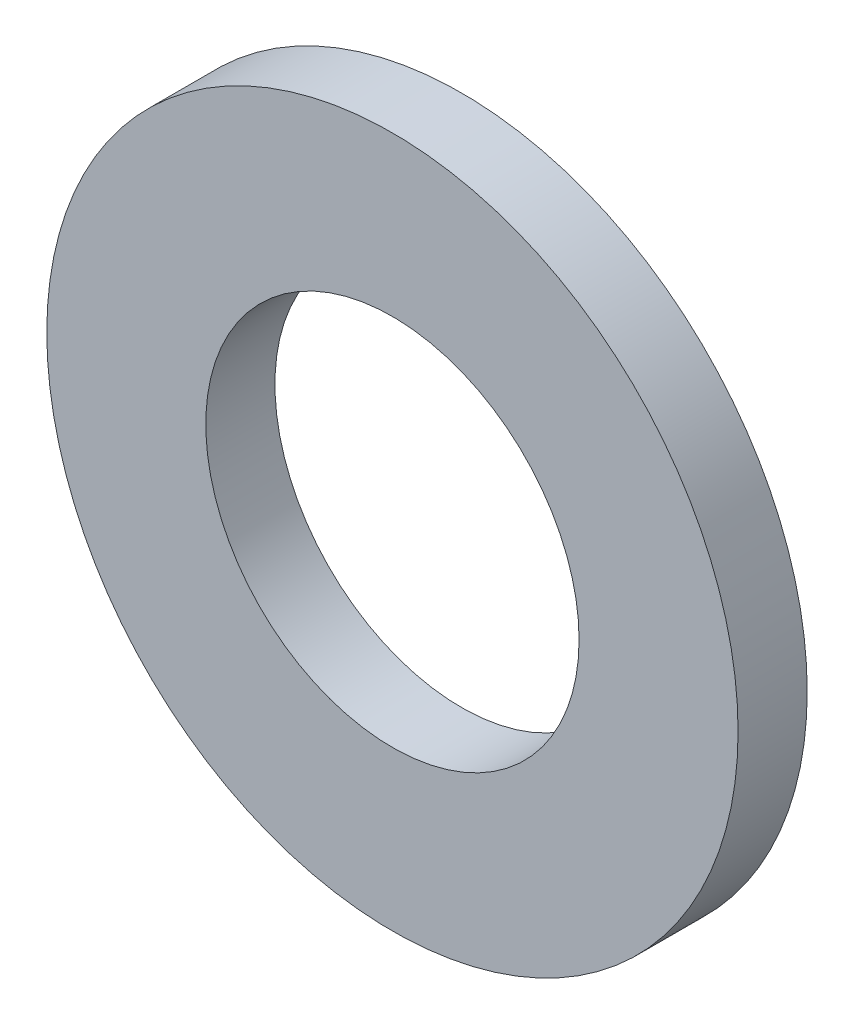
from build123d import *

# Parameters (mm, degrees)
SKETCH2_R                   = 5
CLEARANCE_WASHER_DEPTH      = 1
SKETCH3_R                   = 2.7
CLEARANCE_WASHER_BORE_DEPTH = 1


with BuildPart() as part:
    # Sketch2 → Clearance_washer (new body)
    with BuildSketch(Plane.XY):
        Circle(SKETCH2_R)
    extrude(amount=CLEARANCE_WASHER_DEPTH)

    # Sketch3 → Clearance_washer_bore (cut)
    with BuildSketch(Plane.XY):
        Circle(SKETCH3_R)
    extrude(amount=CLEARANCE_WASHER_BORE_DEPTH, mode=Mode.SUBTRACT)


solid = part.part
